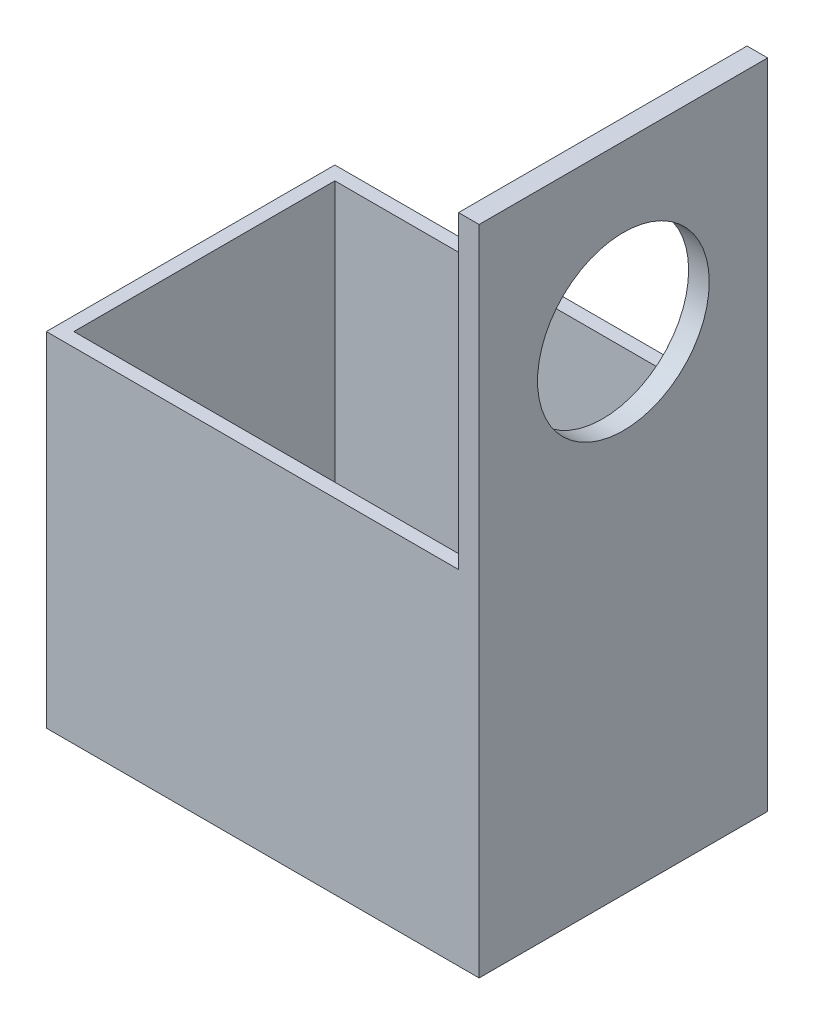
from build123d import *

# Parameters (mm, degrees)
SKETCH1_W           = 60
SKETCH1_H           = 42
SKETCH1_W_2         = 56
SKETCH1_H_2         = 38
BOSS_EXTRUDE1_DEPTH = 50
SKETCH2_W           = 42
SKETCH2_H           = 95
BOSS_EXTRUDE2_DEPTH = 3
SKETCH3_R           = 12.5
CUT_EXTRUDE1_DEPTH  = 3


with BuildPart() as part:
    # Sketch1 → Boss-Extrude1 (new body)
    with BuildSketch(Plane(origin=(0, 0, 0), x_dir=(1, 0, 0), z_dir=(0, 1, 0))):
        Rectangle(SKETCH1_W, SKETCH1_H)
        Rectangle(SKETCH1_W_2, SKETCH1_H_2, mode=Mode.SUBTRACT)
    extrude(amount=BOSS_EXTRUDE1_DEPTH)

    # Sketch2 → Boss-Extrude2 (add)
    with BuildSketch(Plane(origin=(30, 0, 0), x_dir=(0, 0, -1), z_dir=(1, 0, 0))):
        with Locations((0, 47.5)):
            Rectangle(SKETCH2_W, SKETCH2_H)
    extrude(amount=BOSS_EXTRUDE2_DEPTH)

    # Sketch3 → Cut-Extrude1 (cut)
    with BuildSketch(Plane(origin=(33, 0, 0), x_dir=(0, 0, -1), z_dir=(1, 0, 0))):
        with Locations((0, 71)):
            Circle(SKETCH3_R)
    extrude(amount=-CUT_EXTRUDE1_DEPTH, mode=Mode.SUBTRACT)


solid = part.part
